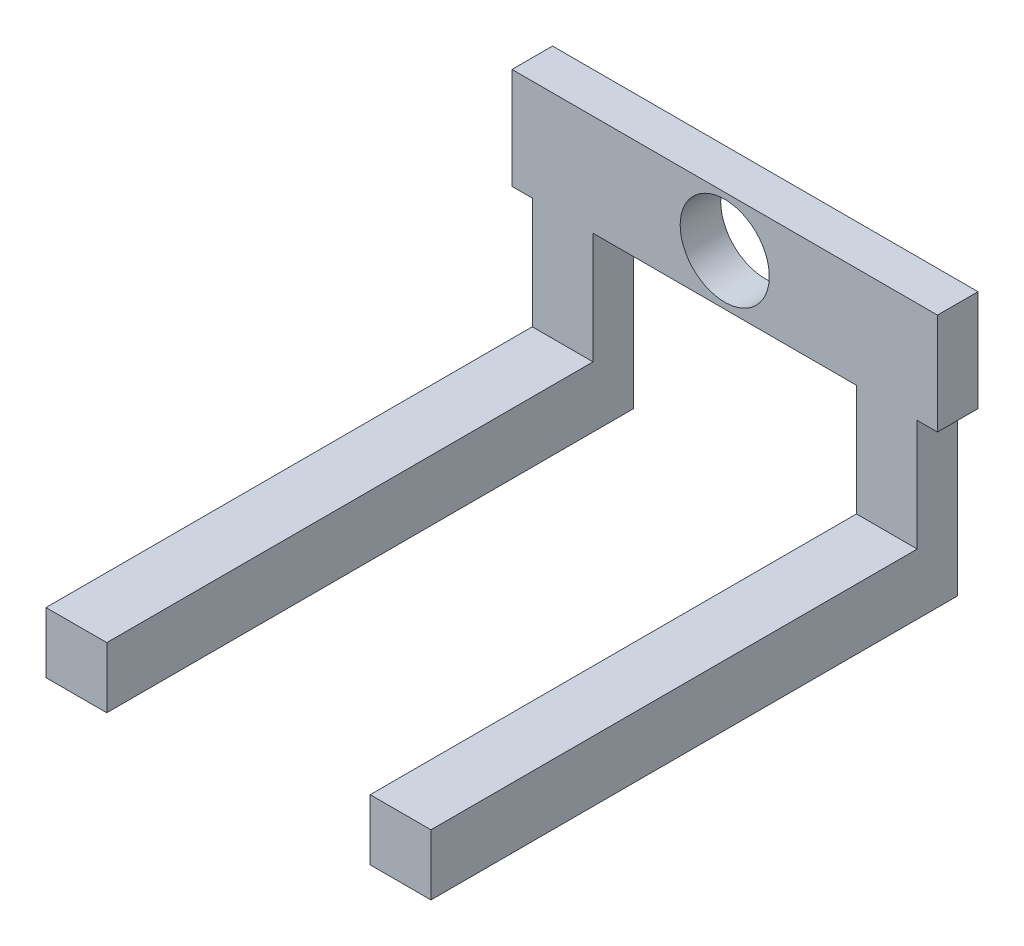
from build123d import *

# Parameters (mm, degrees)
IZIM1_W                       = 15
IZIM1_H                       = 15
Y_KSEKLIK_EKSTR_ZYON1_DEPTH   = 125
Y_KSEKLIK_EKSTR_ZYON1_2_DEPTH = 125
Y_KSEKLIK_EKSTR_ZYON4_DEPTH   = 5
Y_KSEKLIK_EKSTR_ZYON5_REACH   = 179.359
IZIM6_W                       = 15
IZIM6_H                       = 15
IZIM7_R                       = 11
KES_EKSTR_ZYON2_DEPTH         = 53


with BuildPart() as part:
    # Çizim1 → Yükseklik-Ekstrüzyon1 (new body)
    with BuildSketch(Plane.XY):
        with Locations((7.5, 7.5)):
            Rectangle(IZIM1_W, IZIM1_H)
    extrude(amount=Y_KSEKLIK_EKSTR_ZYON1_DEPTH)



with BuildPart() as body_2:
    # Çizim1 → Y_kseklik-Ekstr_zyon1 2 (new body)
    with BuildSketch(Plane.XY):
        with Locations((87.5, 7.5)):
            Rectangle(IZIM1_W, IZIM1_H)
    extrude(amount=Y_KSEKLIK_EKSTR_ZYON1_2_DEPTH)


with BuildPart() as part_1:
    add(part.part)

    add(body_2.part)  # Yükseklik-Ekstrüzyon4 merges body 2
    # Çizim3 → Yükseklik-Ekstrüzyon4 (add, symmetric)
    with BuildSketch(Plane(origin=(0, 0, 0), x_dir=(-1, 0, 0), z_dir=(0, 0, -1))):
        Polygon((-95, 67.5), (-100, 67.5), (-100, 42.5), (-95, 42.5), (-95, 15), (-80, 15), (-80, 42.5), (-15, 42.5), (-15, 0), (0, 0), (0, 42.5), (5, 42.5), (5, 67.5), (0, 67.5), (-15, 67.5), (-80, 67.5), align=None)
    extrude(amount=Y_KSEKLIK_EKSTR_ZYON4_DEPTH, both=True)

    # Çizim6 → Yükseklik-Ekstrüzyon5 (add, up to next)
    with BuildSketch(Plane(origin=(0, 0, -5), x_dir=(-1, 0, 0), z_dir=(0, 0, -1)), mode=Mode.PRIVATE) as y_kseklik_ekstr_zyon5_sk1:
        with Locations((-87.5, 7.5)):
            Rectangle(IZIM6_W, IZIM6_H)
    y_kseklik_ekstr_zyon5_tool1 = extrude(y_kseklik_ekstr_zyon5_sk1.sketch, amount=-Y_KSEKLIK_EKSTR_ZYON5_REACH, mode=Mode.PRIVATE) - part_1.part
    add(y_kseklik_ekstr_zyon5_tool1.solids().sort_by_distance((87.5, 7.5, -5))[0])

    # Çizim7 → Kes-Ekstrüzyon2 (cut)
    with BuildSketch(Plane(origin=(0, 0, -5), x_dir=(-1, 0, 0), z_dir=(0, 0, -1))):
        with Locations((-47.5, 55)):
            Circle(IZIM7_R)
    extrude(amount=-KES_EKSTR_ZYON2_DEPTH, mode=Mode.SUBTRACT)


solid = part_1.part
